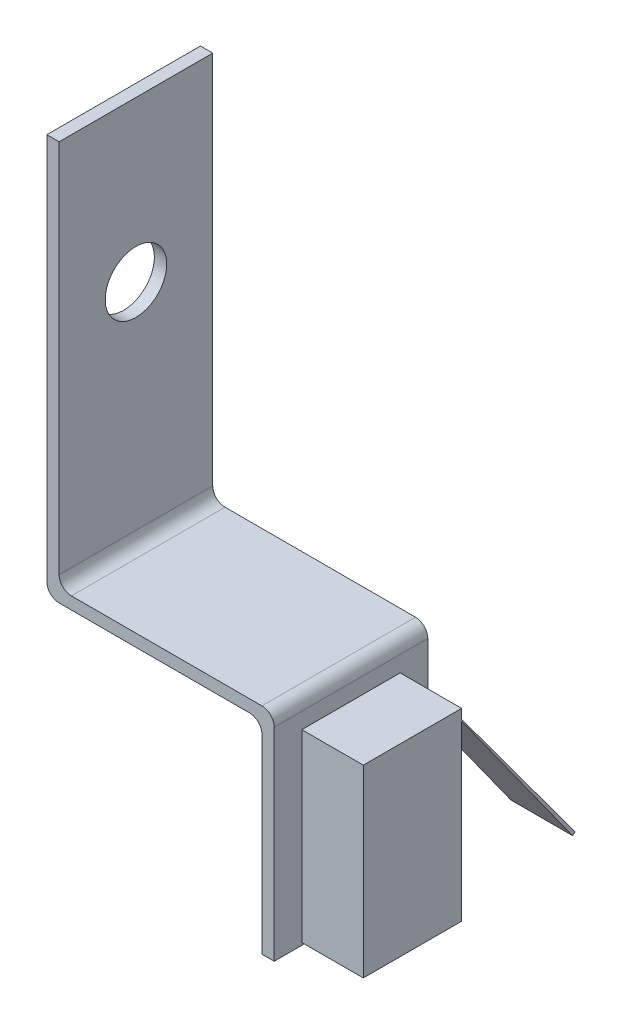
from build123d import *

# Parameters (mm, degrees)
BOSS_EXTRUDE1_DEPTH      = 12.5
BOSS_EXTRUDE1_DEPTH_BACK = 12.5
F_10_0MM_DOWEL_HOLE1_D   = 10
FILLET1_R                = 2
SKETCH3_W                = 16
SKETCH3_H                = 30
BOSS_EXTRUDE2_DEPTH      = 10
BOSS_EXTRUDE3_DEPTH      = 10


with BuildPart() as part:
    # Sketch1 → Boss-Extrude1 (new, two sides: drawn at the far end of the back side and taken through both)
    with BuildSketch(Plane.XY.offset(-BOSS_EXTRUDE1_DEPTH_BACK)):
        Polygon((0, 0), (2, 0), (2, -63), (37, -63), (37, -98), (35, -98), (35, -65), (0, -65), align=None)
    extrude(amount=BOSS_EXTRUDE1_DEPTH + BOSS_EXTRUDE1_DEPTH_BACK)

    # Ø10.0mm Dowel Hole1 (through all)
    with Locations(Plane(origin=(2, -26, 0), x_dir=(0, 1, 0), z_dir=(1, 0, 0))):
        with Locations((0, 0)):
            Hole(F_10_0MM_DOWEL_HOLE1_D / 2)

    # Fillet1
    fillet1_edges = [part.edges().sort_by_distance(p)[0] for p in [
        (35, -65, 0),
        (0, -65, 0),
        (2, -63, 0),
        (37, -63, 0),
    ]]
    fillet(fillet1_edges, radius=FILLET1_R)

    # Sketch3 → Boss-Extrude2 (add)
    with BuildSketch(Plane(origin=(37, 0, 0), x_dir=(0, 0, -1), z_dir=(1, 0, 0))):
        with Locations((0, -82.60435288)):
            Rectangle(SKETCH3_W, SKETCH3_H)
    extrude(amount=BOSS_EXTRUDE2_DEPTH)

    # Sketch4 → Boss-Extrude3 (add)
    with BuildSketch(Plane(origin=(47, 0, 0), x_dir=(0, 0, -1), z_dir=(1, 0, 0))):
        Polygon((8, -69.410399443), (8, -69.135252509), (26.480043417, -94.242566668), (26.046645408, -94.559298491), align=None)
    extrude(amount=-BOSS_EXTRUDE3_DEPTH)


solid = part.part
